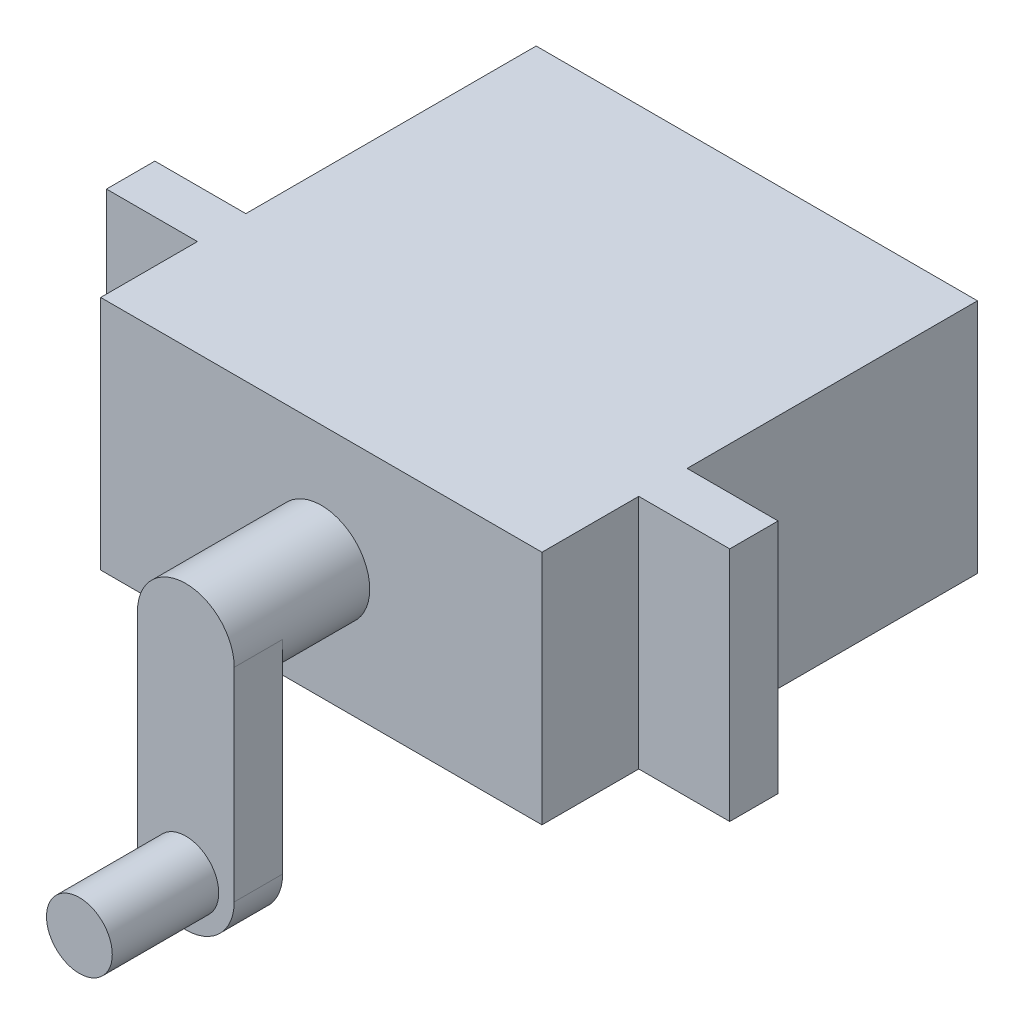
from build123d import *
from build123d.topology import SkipClean

# Parameters (mm, degrees)
CORPS_SG90_START               = -17
ESQUISSE1_W                    = 22.8
ESQUISSE1_H                    = 12.2
CORPS_SG90_DEPTH               = 22.5
PATTES_FIXATION_START          = -22
ESQUISSE2_W                    = 32.2
ESQUISSE2_H                    = 12.2
PATTES_FIXATION_DEPTH          = 2.5
AXE_SERVO_START                = -12.5
ESQUISSE3_R                    = 2.5
AXE_SERVO_DEPTH                = 4.5
PALONNIER_POINT_MORT_BAS_START = -10
PALONNIER_POINT_MORT_BAS_DEPTH = 2.5
ERGOT_ENTRAINEMENT_START       = -4.5
ESQUISSE5_R                    = 1.7
ERGOT_ENTRAINEMENT_DEPTH       = 5.5


with BuildPart() as part:
    # Esquisse1 → Corps_SG90 (new body)
    with BuildSketch(Plane.XY.offset(CORPS_SG90_START)):
        with Locations((0, 43)):
            Rectangle(ESQUISSE1_W, ESQUISSE1_H)
    extrude(amount=-CORPS_SG90_DEPTH)

    # Esquisse2 → Pattes_fixation (add)
    with BuildSketch(Plane.XY.offset(PATTES_FIXATION_START)):
        with Locations((0, 43)):
            Rectangle(ESQUISSE2_W, ESQUISSE2_H)
    extrude(amount=-PATTES_FIXATION_DEPTH)

    # Esquisse3 → Axe_servo (add)
    with BuildSketch(Plane.XY.offset(AXE_SERVO_START)):
        with Locations((0, 43)):
            Circle(ESQUISSE3_R)
    extrude(amount=-AXE_SERVO_DEPTH)

    # Esquisse4 → Palonnier_point_mort_bas (add)
    with SkipClean():  # the faces are left unmerged after this step: merging them gives an invalid solid
        with BuildSketch(Plane.XY.offset(PALONNIER_POINT_MORT_BAS_START)):
            with BuildLine():
                Line((-2.5, 32.5), (-2.5, 43))
                ThreePointArc((-2.5, 43), (0, 45.5), (2.5, 43))
                Line((2.5, 43), (2.5, 32.5))
                ThreePointArc((2.5, 32.5), (0, 30), (-2.5, 32.5))
            make_face()
        extrude(amount=-PALONNIER_POINT_MORT_BAS_DEPTH)

    # Esquisse5 → Ergot_entrainement (add)
    with SkipClean():  # the faces are left unmerged after this step: merging them gives an invalid solid
        with BuildSketch(Plane.XY.offset(ERGOT_ENTRAINEMENT_START)):
            with Locations((0, 32.5)):
                Circle(ESQUISSE5_R)
        extrude(amount=-ERGOT_ENTRAINEMENT_DEPTH)


solid = part.part
